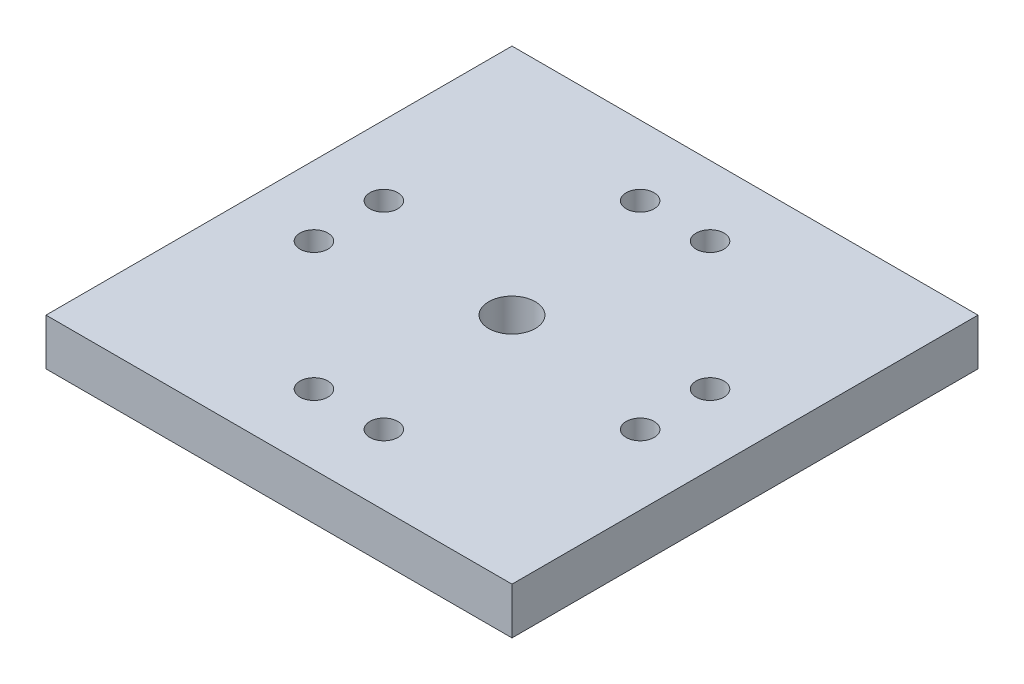
from build123d import *

# Parameters (mm, degrees)
SKETCH1_W           = 100
SKETCH1_H           = 100
SKETCH1_R           = 5
SKETCH1_R_2         = 3
BOSS_EXTRUDE1_DEPTH = 10


with BuildPart() as part:
    # Sketch1 → Boss-Extrude1 (new body)
    with BuildSketch(Plane(origin=(0, 0, 0), x_dir=(1, 0, 0), z_dir=(0, 1, 0))):
        Rectangle(SKETCH1_W, SKETCH1_H)
        with Locations(Location((0, 0, 0), (0, 0, 270))):
            Circle(SKETCH1_R, mode=Mode.SUBTRACT)
        with Locations(Location((-7.5, 35, 0), (0, 0, 270))):
            Circle(SKETCH1_R_2, mode=Mode.SUBTRACT)
        with Locations(Location((7.5, 35, 0), (0, 0, 270))):
            Circle(SKETCH1_R_2, mode=Mode.SUBTRACT)
        with Locations(Location((35, 7.5, 0), (0, 0, 270))):
            Circle(SKETCH1_R_2, mode=Mode.SUBTRACT)
        with Locations(Location((35, -7.5, 0), (0, 0, 270))):
            Circle(SKETCH1_R_2, mode=Mode.SUBTRACT)
        with Locations(Location((7.5, -35, 0), (0, 0, 270))):
            Circle(SKETCH1_R_2, mode=Mode.SUBTRACT)
        with Locations(Location((-7.5, -35, 0), (0, 0, 270))):
            Circle(SKETCH1_R_2, mode=Mode.SUBTRACT)
        with Locations(Location((-35, -7.5, 0), (0, 0, 270))):
            Circle(SKETCH1_R_2, mode=Mode.SUBTRACT)
        with Locations(Location((-35, 7.5, 0), (0, 0, 270))):
            Circle(SKETCH1_R_2, mode=Mode.SUBTRACT)
    extrude(amount=BOSS_EXTRUDE1_DEPTH)


solid = part.part
